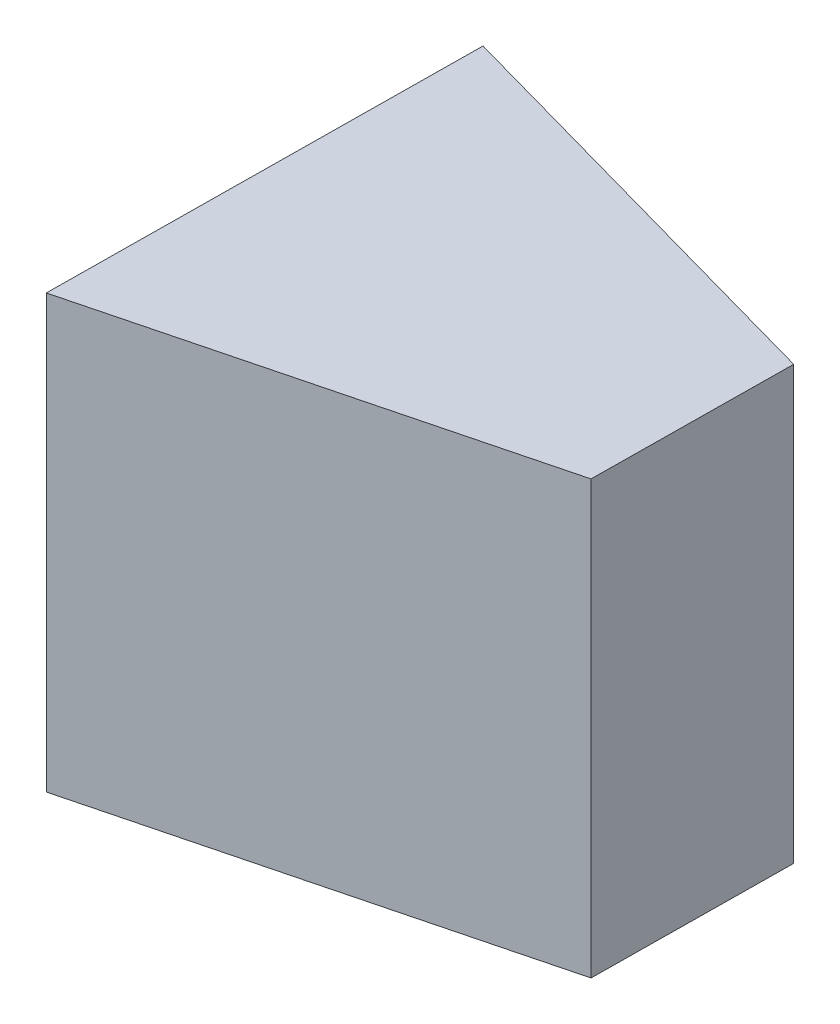
from build123d import *

# Parameters (mm, degrees)
BOSS_EXTRU_1_DEPTH = 50
D_POUILLE7_ANGLE   = 15
D_POUILLE8_ANGLE   = -15


with BuildPart() as part:
    # Esquisse1 → Boss.-Extru.1 (new body)
    with BuildSketch(Plane(origin=(0, 0, 0), x_dir=(1, 0, 0), z_dir=(0, 1, 0))):
        Polygon((25.259584223, 24.737691987), (-24.737691987, 25.259584223), (-25.259584223, -24.737691987), (24.737691987, -25.259584223), align=None)
    extrude(amount=BOSS_EXTRU_1_DEPTH)

    # Dépouille7
    d_pouille7_faces = [part.faces().sort_by_distance(p)[0] for p in [
        (0.260946118, 25, -24.998638105),
        (-0.260946118, 25, 24.998638105),
    ]]
    draft(d_pouille7_faces, Plane(origin=(-24.737691987, 50, -25.259584223), x_dir=(0.010437844720406831, 0, -0.9999455242149908), z_dir=(-0.9999455242149908, 0, -0.010437844720406831)), D_POUILLE7_ANGLE)

    # Dépouille8
    d_pouille8_faces = [part.faces().sort_by_distance(p)[0] for p in [
        (0.33086642, 25, -31.697002998),
        (-0.33086642, 25, 31.697002998),
    ]]
    draft(d_pouille8_faces, Plane(origin=(-24.737691987, 50, -25.259584223), x_dir=(0.010437844720406831, 0, -0.9999455242149908), z_dir=(-0.9999455242149908, 0, -0.010437844720406831)), D_POUILLE8_ANGLE)


solid = part.part
